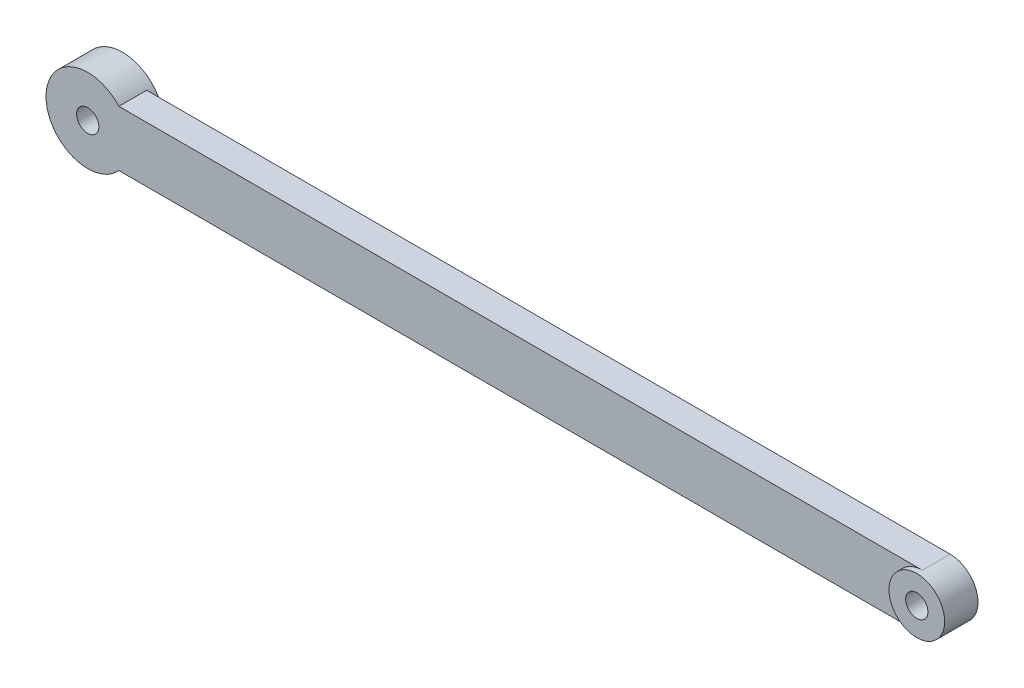
from build123d import *
from build123d.topology import SkipClean

# Parameters (mm, degrees)
SKETCH1_R             = 15
BOSS_EXTRUDE1_DEPTH   = 10
SKETCH1_R_2           = 10
BOSS_EXTRUDE1_2_DEPTH = 10
BOSS_EXTRUDE3_DEPTH   = 10
SKETCH13_R            = 4
CUT_EXTRUDE1_DEPTH    = 20
BOSS_EXTRUDE7_START   = 2.5
SKETCH14_R            = 15
SKETCH14_R_2          = 4
BOSS_EXTRUDE7_DEPTH   = 2.5
SKETCH15_R            = 4
BOSS_EXTRUDE8_DEPTH   = 2


with BuildPart() as part:
    # Sketch1 → Boss-Extrude1 (new body)
    with BuildSketch(Plane.XY):
        Circle(SKETCH1_R)
    extrude(amount=BOSS_EXTRUDE1_DEPTH)



with BuildPart() as body_2:
    # Sketch1 → Boss-Extrude1 2 (new body)
    with BuildSketch(Plane.XY):
        with Locations((300, 0)):
            Circle(SKETCH1_R_2)
    extrude(amount=BOSS_EXTRUDE1_2_DEPTH)


with BuildPart() as part_1:
    add(part.part)

    add(body_2.part)  # Boss-Extrude3 merges body 2
    # Sketch5 → Boss-Extrude3 (add)
    with BuildSketch(Plane.XY):
        with BuildLine():
            Line((300, 10), (11.180339887, 10))
            ThreePointArc((11.180339887, 10), (14.012585384, 5.352331347), (15, 0))
            ThreePointArc((15, 0), (14.012585384, -5.352331347), (11.180339887, -10))
            Line((11.180339887, -10), (300, -10))
            ThreePointArc((300, -10), (290, 0), (300, 10))
        make_face()
    extrude(amount=BOSS_EXTRUDE3_DEPTH)

    # Sketch13 → Cut-Extrude1 (cut)
    with BuildSketch(Plane(origin=(0, 0, 0), x_dir=(-1, 0, 0), z_dir=(0, 0, -1))):
        with Locations((-300, 0)):
            Circle(SKETCH13_R)
        Circle(SKETCH13_R)
    extrude(amount=-CUT_EXTRUDE1_DEPTH, mode=Mode.SUBTRACT)

    # Sketch14 → Boss-Extrude7 (add)
    with BuildSketch(Plane(origin=(0, 0, 0), x_dir=(-1, 0, 0), z_dir=(0, 0, -1)).offset(BOSS_EXTRUDE7_START)):
        Circle(SKETCH14_R)
        Circle(SKETCH14_R_2, mode=Mode.SUBTRACT)
    extrude(amount=-BOSS_EXTRUDE7_DEPTH)

    # Sketch15 → Boss-Extrude8 (add)
    with SkipClean():  # the faces are left unmerged after this step: merging them gives an invalid solid
        with BuildSketch(Plane.XY.offset(10)):
            with BuildLine():
                ThreePointArc((300, 10), (290, 0), (300, -10))
                ThreePointArc((300, -10), (307.071067812, -7.071067812), (310, 0))
                ThreePointArc((310, 0), (307.071067812, 7.071067812), (300, 10))
            make_face()
            with Locations((300, 0)):
                Circle(SKETCH15_R, mode=Mode.SUBTRACT)
        extrude(amount=BOSS_EXTRUDE8_DEPTH)


solid = part_1.part
